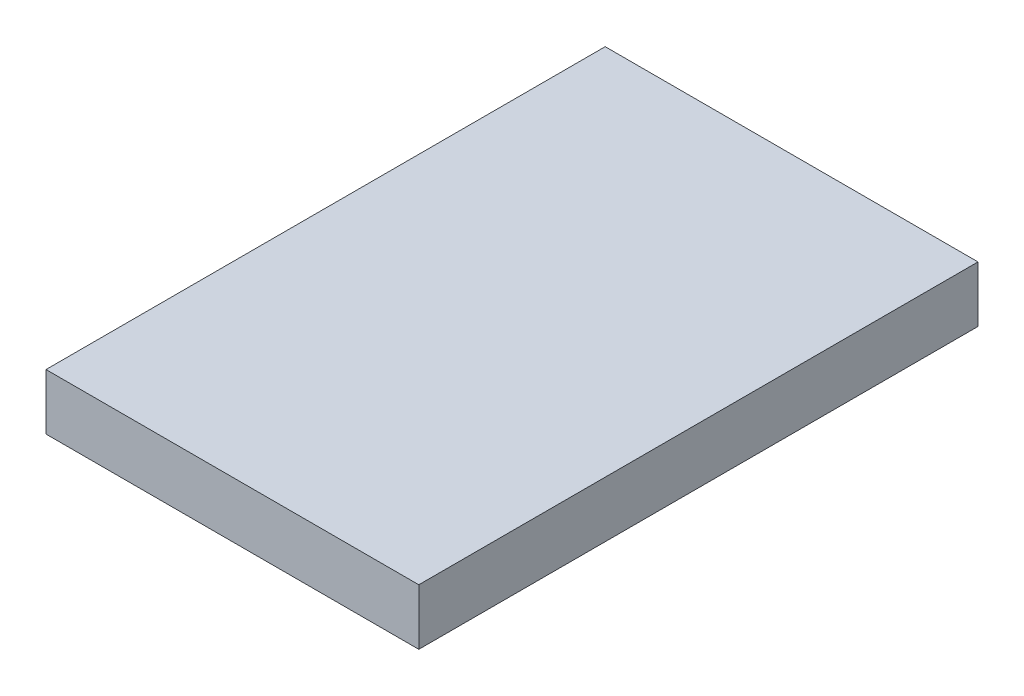
from build123d import *

# Parameters (mm, degrees)
SKETCH1_W           = 20
SKETCH1_H           = 30
BOSS_EXTRUDE1_DEPTH = 3


with BuildPart() as part:
    # Sketch1 → Boss-Extrude1 (new body)
    with BuildSketch(Plane(origin=(0, 0, 0), x_dir=(1, 0, 0), z_dir=(0, 1, 0))):
        with Locations((-0.448979592, 0.074829932)):
            Rectangle(SKETCH1_W, SKETCH1_H)
    extrude(amount=BOSS_EXTRUDE1_DEPTH)


solid = part.part
